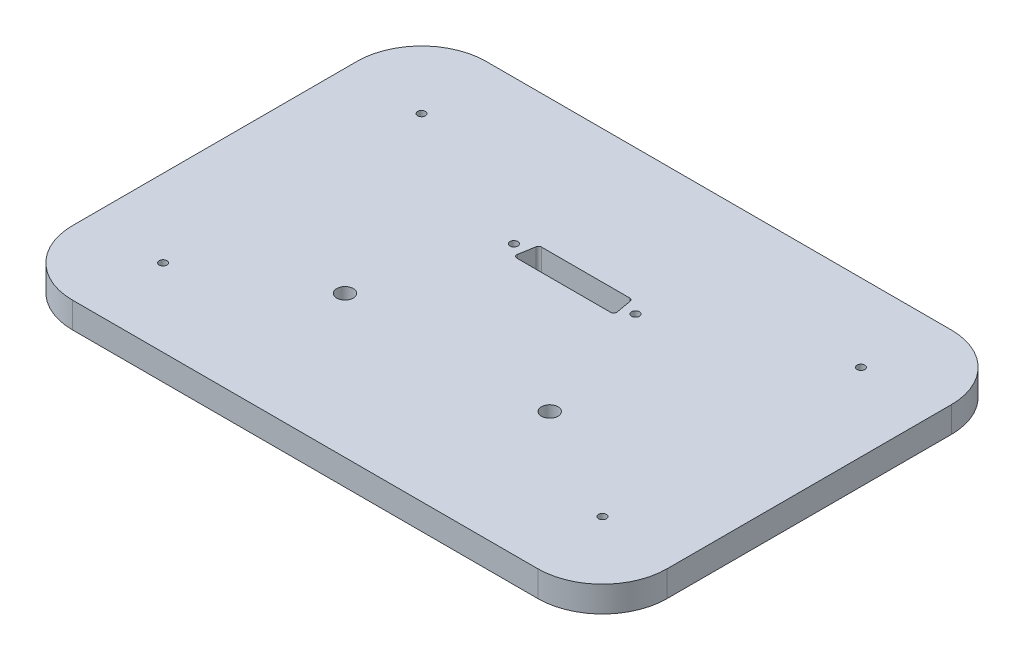
from build123d import *

# Parameters (mm, degrees)
BOSS_EXTRUDE1_DEPTH     = 10
SKETCH3_R               = 1.5
CUT_EXTRUDE1_DEPTH      = 10
SKETCH5_R               = 1.525
SKETCH5_R_2             = 3.2
CUT_EXTRUDE2_DEPTH      = 10
FILLET1_R               = 1.2
CUT_EXTRUDE_THIN1_DEPTH = 5


with BuildPart() as part:
    # Sketch1 → Boss-Extrude1 (new body)
    with BuildSketch(Plane(origin=(0, 0, 0), x_dir=(1, 0, 0), z_dir=(0, 1, 0))):
        with BuildLine():
            Line((-90, -80), (90, -80))
            ThreePointArc((90, -80), (107.67766953, -72.67766953), (115, -55))
            Line((115, -55), (115, 55))
            ThreePointArc((115, 55), (107.67766953, 72.67766953), (90, 80))
            Line((90, 80), (-90, 80))
            ThreePointArc((-90, 80), (-107.67766953, 72.67766953), (-115, 55))
            Line((-115, 55), (-115, -55))
            ThreePointArc((-115, -55), (-107.67766953, -72.67766953), (-90, -80))
        make_face()
    extrude(amount=BOSS_EXTRUDE1_DEPTH)

    # Sketch3 → Cut-Extrude1 (cut)
    with BuildSketch(Plane(origin=(0, 10, 0), x_dir=(1, 0, 0), z_dir=(0, 1, 0))):
        with Locations(Location((-85, 50, 0), (0, 0, 270))):
            Circle(SKETCH3_R)
        with Locations(Location((85, 50, 0), (0, 0, 270))):
            Circle(SKETCH3_R)
        with Locations(Location((85, -50, 0), (0, 0, 270))):
            Circle(SKETCH3_R)
        with Locations(Location((-85, -50, 0), (0, 0, 270))):
            Circle(SKETCH3_R)
    extrude(amount=-CUT_EXTRUDE1_DEPTH, mode=Mode.SUBTRACT)

    # Sketch5 → Cut-Extrude2 (cut)
    with BuildSketch(Plane.XZ):
        with Locations(Location((23.52, -24.25, 0), (0, 0, 270))):
            Circle(SKETCH5_R)
        with Locations(Location((-23.52, -24.25, 0), (0, 0, 270))):
            Circle(SKETCH5_R)
        with Locations(Location((-39.598222878, 25, 0), (0, 0, 270))):
            Circle(SKETCH5_R_2)
        with Locations(Location((39.598222878, 25, 0), (0, 0, 270))):
            Circle(SKETCH5_R_2)
        Polygon((19.55, -20), (18.051220664, -28.5), (-18.051220664, -28.5), (-19.55, -20), align=None)
    extrude(amount=-CUT_EXTRUDE2_DEPTH, mode=Mode.SUBTRACT)

    # Fillet1
    fillet1_edges = [part.edges().sort_by_distance(p)[0] for p in [
        (-18.051220664, 5, -28.5),
        (-19.55, 5, -20),
        (19.55, 5, -20),
        (18.051220664, 5, -28.5),
    ]]
    fillet(fillet1_edges, radius=FILLET1_R)

    # Sketch7 → Cut-Extrude-Thin1 (cut)
    with BuildSketch(Plane.XZ):
        with BuildLine():
            Line((-85, 67.5), (85, 67.5))
            ThreePointArc((85, 67.5), (97.374368671, 62.374368671), (102.5, 50))
            Line((102.5, 50), (102.5, -50))
            ThreePointArc((102.5, -50), (97.374368671, -62.374368671), (85, -67.5))
            Line((85, -67.5), (-85, -67.5))
            ThreePointArc((-85, -67.5), (-97.374368671, -62.374368671), (-102.5, -50))
            Line((-102.5, -50), (-102.5, 50))
            ThreePointArc((-102.5, 50), (-97.374368671, 62.374368671), (-85, 67.5))
        make_face()
        with BuildLine():
            Line((-85, 62.5), (85, 62.5))
            ThreePointArc((85, 62.5), (93.838834765, 58.838834765), (97.5, 50))
            Line((97.5, 50), (97.5, -50))
            ThreePointArc((97.5, -50), (93.838834765, -58.838834765), (85, -62.5))
            Line((85, -62.5), (-85, -62.5))
            ThreePointArc((-85, -62.5), (-93.838834765, -58.838834765), (-97.5, -50))
            Line((-97.5, -50), (-97.5, 50))
            ThreePointArc((-97.5, 50), (-93.838834765, 58.838834765), (-85, 62.5))
        make_face(mode=Mode.SUBTRACT)
    extrude(amount=-CUT_EXTRUDE_THIN1_DEPTH, mode=Mode.SUBTRACT)


solid = part.part
